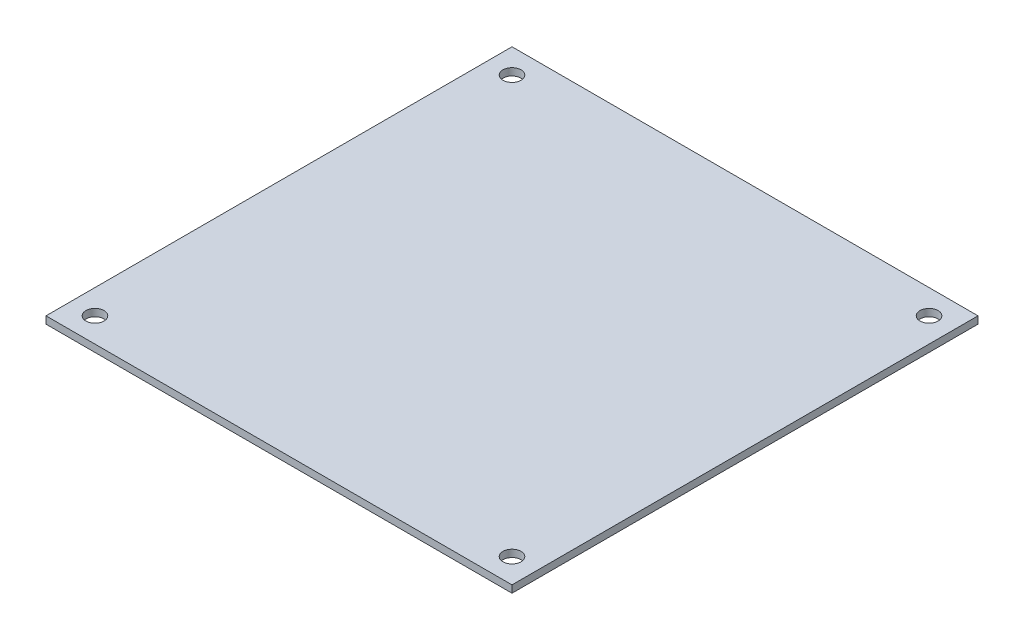
from build123d import *

# Parameters (mm, degrees)
SKETCH1_W           = 1285
SKETCH1_H           = 1285
SKETCH1_R           = 25
BOSS_EXTRUDE1_DEPTH = 10


with BuildPart() as part:
    # Sketch1 → Boss-Extrude1 (new, symmetric)
    with BuildSketch(Plane(origin=(0, 0, 0), x_dir=(1, 0, 0), z_dir=(0, 1, 0))):
        Rectangle(SKETCH1_W, SKETCH1_H)
        with Locations(Location((-575, 575, 0), (0, 0, 270))):
            Circle(SKETCH1_R, mode=Mode.SUBTRACT)
        with Locations(Location((575, 575, 0), (0, 0, 90))):
            Circle(SKETCH1_R, mode=Mode.SUBTRACT)
        with Locations(Location((575, -575, 0), (0, 0, 270))):
            Circle(SKETCH1_R, mode=Mode.SUBTRACT)
        with Locations(Location((-575, -575, 0), (0, 0, 90))):
            Circle(SKETCH1_R, mode=Mode.SUBTRACT)
    extrude(amount=BOSS_EXTRUDE1_DEPTH, both=True)


solid = part.part
